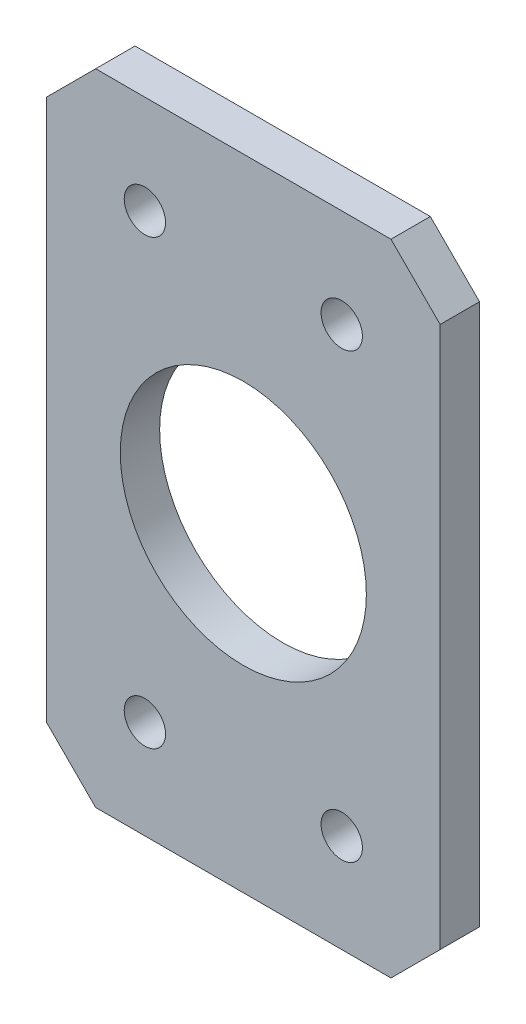
from build123d import *

# Parameters (mm, degrees)
SKETCH_1_W               = 40
SKETCH_1_H               = 65
SKETCH_1_R               = 12.5
EXTRUDE_1_DEPTH          = 2
CUT_EXTRUDE_1_DEPTH      = 39.369910086
CUT_EXTRUDE_1_DEPTH_BACK = 39.369910086
SKETCH_2_R               = 2.1
CHAMFER_2_SIZE           = 5


with BuildPart() as part:
    # 草图1 → 凸台-拉伸1 (new, symmetric)
    with BuildSketch(Plane.XY):
        Rectangle(SKETCH_1_W, SKETCH_1_H)
        Circle(SKETCH_1_R, mode=Mode.SUBTRACT)
    extrude(amount=EXTRUDE_1_DEPTH, both=True)

    # 草图2 → 切除-拉伸1 (cut, two sides: drawn at the far end of the back side and taken through both)
    with BuildSketch(Plane(origin=(0, 0, -2), x_dir=(-1, 0, 0), z_dir=(0, 0, -1)).offset(-CUT_EXTRUDE_1_DEPTH_BACK)):
        with Locations((-10, 22.5)):
            Circle(SKETCH_2_R)
        with Locations((10, 22.5)):
            Circle(SKETCH_2_R)
        with Locations((10, -22.5)):
            Circle(SKETCH_2_R)
        with Locations((-10, -22.5)):
            Circle(SKETCH_2_R)
    extrude(amount=CUT_EXTRUDE_1_DEPTH + CUT_EXTRUDE_1_DEPTH_BACK, mode=Mode.SUBTRACT)

    # 倒角2
    chamfer_2_edges = [part.edges().sort_by_distance(p)[0] for p in [
        (-20, 32.5, 0),
        (20, 32.5, 0),
        (20, -32.5, 0),
        (-20, -32.5, 0),
    ]]
    chamfer(chamfer_2_edges, length=CHAMFER_2_SIZE)


solid = part.part
